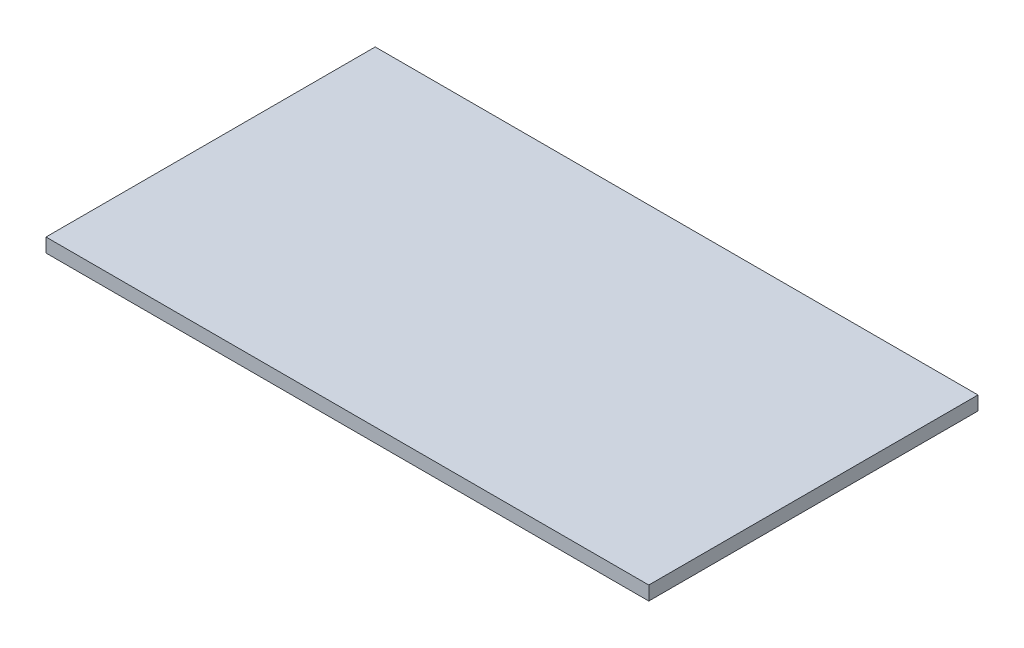
from build123d import *

# Parameters (mm, degrees)
SKETCH1_W           = 66.04
SKETCH1_H           = 36.068
BOSS_EXTRUDE1_DEPTH = 1.524


with BuildPart() as part:
    # Sketch1 → Boss-Extrude1 (new body)
    with BuildSketch(Plane(origin=(0, 0, 0), x_dir=(1, 0, 0), z_dir=(0, 1, 0))):
        with Locations((33.02, 18.034)):
            Rectangle(SKETCH1_W, SKETCH1_H)
    extrude(amount=BOSS_EXTRUDE1_DEPTH)


solid = part.part
